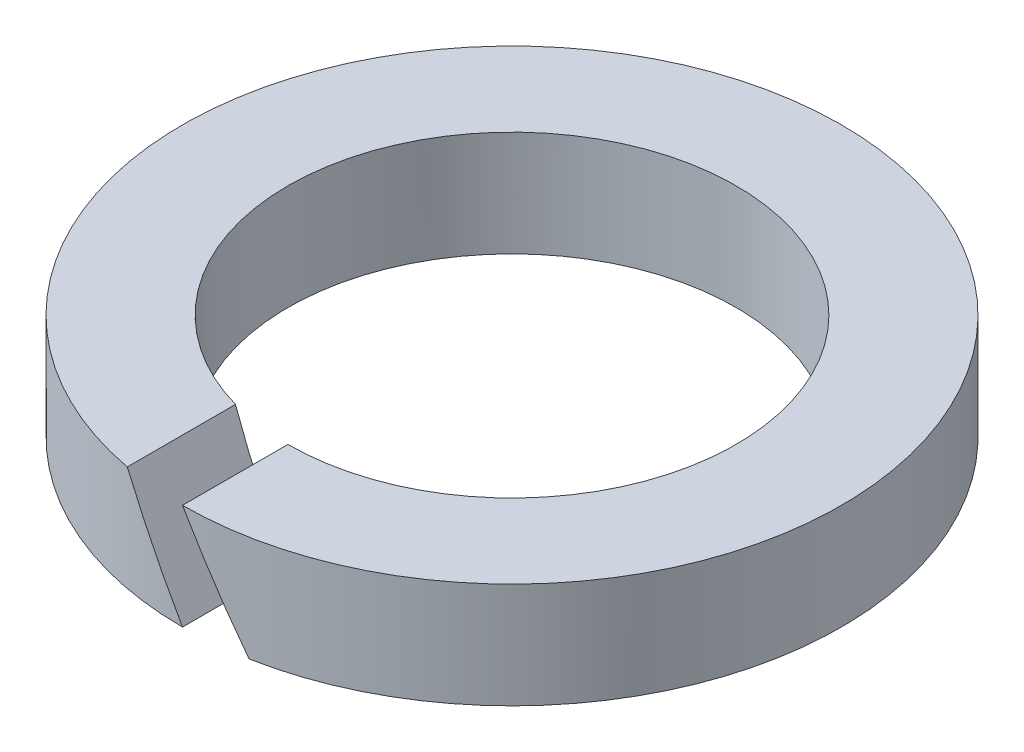
from build123d import *

# Parameters (mm, degrees)
SKETCH_1_W          = 0.8
SKETCH_1_H          = 0.8
CUT_EXTRUDE_1_DEPTH = 4.624913792


with BuildPart() as part:
    # 草图1 → 旋转1 (revolve)
    with BuildSketch(Plane.XY, mode=Mode.PRIVATE) as revolve_1_sk:
        with Locations((2.1, 0.4)):
            Rectangle(SKETCH_1_W, SKETCH_1_H)
    revolve(revolve_1_sk.sketch.rotate(Axis((0, 0, 0), (0, 1, 0)), 90), axis=Axis((0, 0, 0), (0, 1, 0)))

    # 草图2 → 切除-拉伸1 (cut, through all)
    with BuildSketch(Plane.XY):
        Polygon((0, 0), (0.461880215, 0), (0, 0.8), (-0.461880215, 0.8), align=None)
    extrude(amount=CUT_EXTRUDE_1_DEPTH, mode=Mode.SUBTRACT)


solid = part.part
